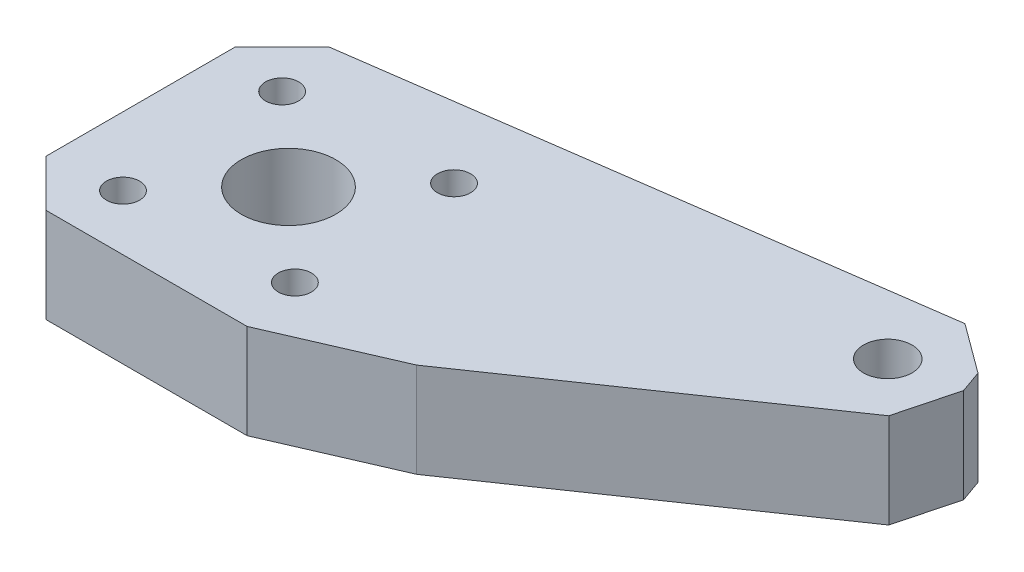
from build123d import *

# Parameters (mm, degrees)
SKETCH_1_R      = 4
SKETCH_1_R_2    = 2.05
SKETCH_1_R_3    = 1.4
EXTRUDE_1_DEPTH = 8


with BuildPart() as part:
    # 草图1 → 凸台-拉伸1 (new body)
    with BuildSketch(Plane(origin=(0, 0, 0), x_dir=(1, 0, 0), z_dir=(0, 1, 0))):
        Polygon((0, 0), (-3.959797975, 3.959797975), (-3.959797975, 19.959797975), (0, 23.919595949), (47.136760072, 30.544235555), (51.309361757, 27.474741267), (51.976478872, 25.589282502), (50.662813892, 20.578625428), (26.998999911, 4.339354882), (17, 0), align=None)
        with Locations(Location((8.540202025, 11.959797975, 0), (0, 0, 270))):
            Circle(SKETCH_1_R, mode=Mode.SUBTRACT)
        with Locations(Location((46.457908711, 24.697439818, 0), (0, 0, 270))):
            Circle(SKETCH_1_R_2, mode=Mode.SUBTRACT)
        with Locations(Location((1.274956594, 18.684841381, 0), (0, 0, 270))):
            Circle(SKETCH_1_R_3, mode=Mode.SUBTRACT)
        with Locations(Location((15.265245432, 19.225043406, 0), (0, 0, 270))):
            Circle(SKETCH_1_R_3, mode=Mode.SUBTRACT)
        with Locations(Location((15.805447457, 5.234754568, 0), (0, 0, 270))):
            Circle(SKETCH_1_R_3, mode=Mode.SUBTRACT)
        with Locations(Location((1.815158619, 4.694552543, 0), (0, 0, 270))):
            Circle(SKETCH_1_R_3, mode=Mode.SUBTRACT)
    extrude(amount=EXTRUDE_1_DEPTH)


solid = part.part
